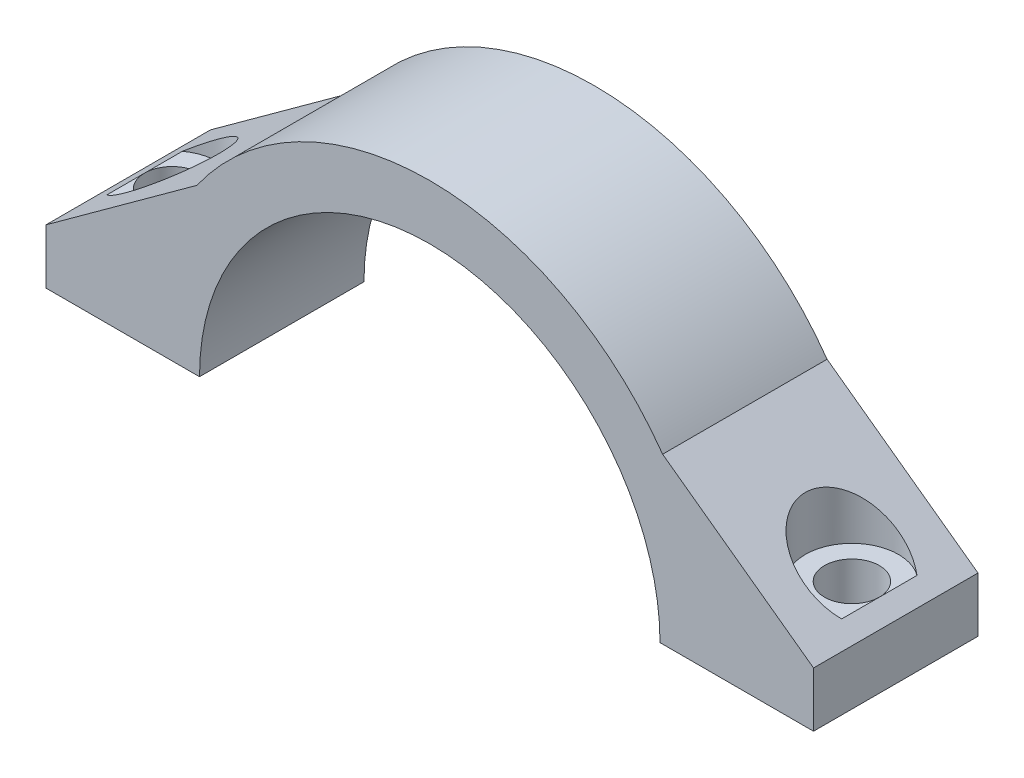
from build123d import *

# Parameters (mm, degrees)
SALIENTE_EXTRUIR1_DEPTH = 7.5
SALIENTE_EXTRUIR2_DEPTH = 7.5
CROQUIS3_R              = 2.5
CORTAR_EXTRUIR1_DEPTH   = 45.240818256
CROQUIS4_R              = 4.25
CORTAR_EXTRUIR2_DEPTH   = 41.959224846


with BuildPart() as part:
    # Croquis1 → Saliente-Extruir1 (new, symmetric)
    with BuildSketch(Plane.XY):
        with BuildLine():
            Line((-26, 0), (-21, 0))
            ThreePointArc((-21, 0), (0, 21), (21, 0))
            Line((21, 0), (26, 0))
            ThreePointArc((26, 0), (0, 26), (-26, 0))
        make_face()
    extrude(amount=SALIENTE_EXTRUIR1_DEPTH, both=True)

    # Croquis2 → Saliente-Extruir2 (add, symmetric)
    with BuildSketch(Plane.XY):
        with BuildLine():
            Line((26, 0), (35, 0))
            Line((35, 0), (35, 5))
            Line((35, 5), (21.236760582, 15))
            ThreePointArc((21.236760582, 15), (24.78059498, 7.869060455), (26, 0))
        make_face()
    saliente_extruir2 = extrude(amount=SALIENTE_EXTRUIR2_DEPTH, both=True)

    # Croquis3 → Cortar-Extruir1 (cut, through all)
    with BuildSketch(Plane.XZ):
        with Locations(Location((31, 0, 0), (0, 0, 270))):
            Circle(CROQUIS3_R)
    cortar_extruir1 = extrude(amount=-CORTAR_EXTRUIR1_DEPTH, mode=Mode.SUBTRACT)

    # Croquis4 → Cortar-Extruir2 (cut, through all)
    with BuildSketch(Plane(origin=(0, 6.09, 0), x_dir=(-1, 0, 0), z_dir=(0, -1, 0))):
        with Locations((-31, 0)):
            Circle(CROQUIS4_R)
    cortar_extruir2 = extrude(amount=-CORTAR_EXTRUIR2_DEPTH, mode=Mode.SUBTRACT)

    # Simetría1: Saliente-Extruir2, Cortar-Extruir1, Cortar-Extruir2 across plane
    add(saliente_extruir2.mirror(Plane(origin=(0, 0, 0), x_dir=(0, 0, 1), z_dir=(1, 0, 0))))
    add(cortar_extruir1.mirror(Plane(origin=(0, 0, 0), x_dir=(0, 0, 1), z_dir=(1, 0, 0))), mode=Mode.SUBTRACT)
    add(cortar_extruir2.mirror(Plane(origin=(0, 0, 0), x_dir=(0, 0, 1), z_dir=(1, 0, 0))), mode=Mode.SUBTRACT)


solid = part.part
